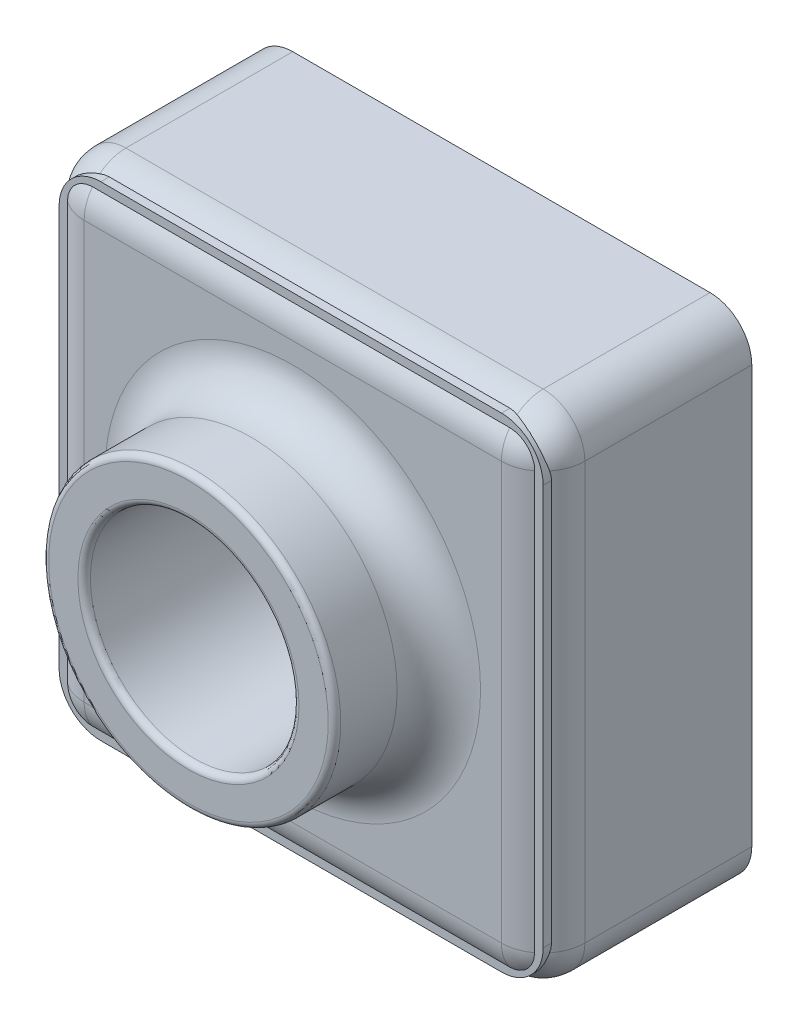
from build123d import *

# Parameters (mm, degrees)
SKETCH2_W           = 120
SKETCH2_H           = 120
BOSS_EXTRUDE1_DEPTH = 50
SKETCH3_R           = 35
BOSS_EXTRUDE2_DEPTH = 25
SKETCH5_R           = 25
CUT_EXTRUDE3_DEPTH  = 128.955610521
FILLET2_R           = 1.5
SHELL1_T            = -2
FILLET6_R           = 10


with BuildPart() as part:
    # Sketch2 → Boss-Extrude1 (new body)
    with BuildSketch(Plane.XY):
        with Locations((14.168674699, -12.43373494)):
            Rectangle(SKETCH2_W, SKETCH2_H)
    extrude(amount=BOSS_EXTRUDE1_DEPTH)

    # Sketch3 → Boss-Extrude2 (add)
    with BuildSketch(Plane.XY.offset(50)):
        with Locations((14.168674699, -12.43373494)):
            Circle(SKETCH3_R)
    extrude(amount=BOSS_EXTRUDE2_DEPTH)

    # Sketch5 → Cut-Extrude3 (cut, through all)
    with BuildSketch(Plane.XY.offset(75)):
        with Locations((14.168674699, -12.43373494)):
            Circle(SKETCH5_R)
    extrude(amount=-CUT_EXTRUDE3_DEPTH, mode=Mode.SUBTRACT)

    # Fillet2
    fillet2_edges = [part.edges().sort_by_distance(p)[0] for p in [
        (-20.831325301, -12.43373494, 75),
        (-10.831325301, -12.43373494, 75),
    ]]
    fillet(fillet2_edges, radius=FILLET2_R)

    # Shell1
    shell1_openings = [part.faces().sort_by_distance(p)[0] for p in [
        (14.168674699, 45.869208785, 0),
    ]]
    offset(amount=SHELL1_T, openings=shell1_openings, kind=Kind.INTERSECTION)

    # Fillet6
    fillet6_edges = [part.edges().sort_by_distance(p)[0] for p in [
        (74.168674699, -12.43373494, 50),
        (-20.831325301, -12.43373494, 50),
        (14.168674699, 47.56626506, 50),
        (-43.831325301, 45.56626506, 24),
        (-43.831325301, -70.43373494, 24),
        (72.168674699, -70.43373494, 24),
        (72.168674699, 45.56626506, 24),
        (-45.831325301, -12.43373494, 50),
        (-45.831325301, 47.56626506, 25),
        (74.168674699, 47.56626506, 25),
        (74.168674699, -72.43373494, 25),
        (-45.831325301, -72.43373494, 25),
        (14.168674699, -72.43373494, 50),
    ]]
    fillet(fillet6_edges, radius=FILLET6_R)


solid = part.part
